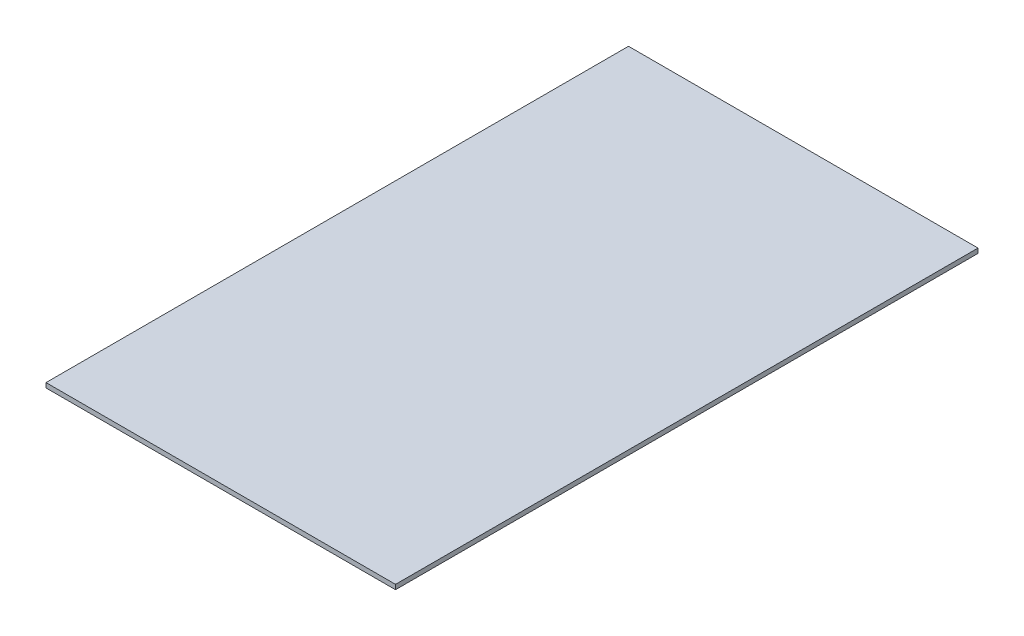
from build123d import *

# Parameters (mm, degrees)
SKETCH1_W           = 450
SKETCH1_H           = 750
BOSS_EXTRUDE1_DEPTH = 6


with BuildPart() as part:
    # Sketch1 → Boss-Extrude1 (new body)
    with BuildSketch(Plane(origin=(0, 0, 0), x_dir=(1, 0, 0), z_dir=(0, 1, 0))):
        Rectangle(SKETCH1_W, SKETCH1_H)
    extrude(amount=BOSS_EXTRUDE1_DEPTH)


solid = part.part
